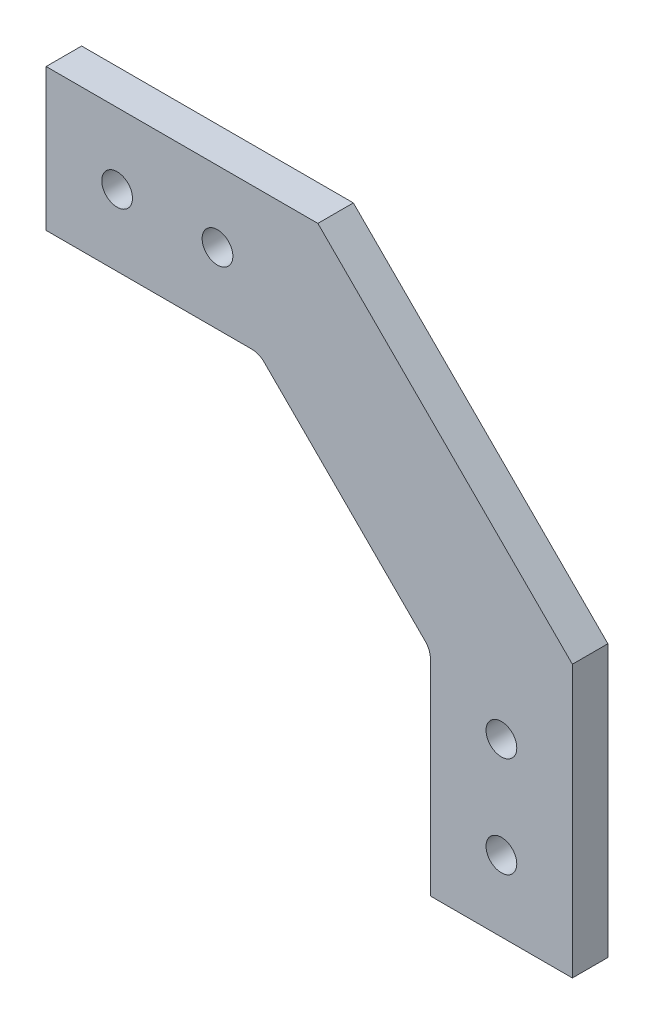
from build123d import *

# Parameters (mm, degrees)
BOSS_EXTRUDE1_DEPTH      = 6.35
FILLET1_R                = 3.175
M5_CLEARANCE_HOLE1_D     = 5.5
M5_CLEARANCE_HOLE1_DEPTH = 18.75
M5_CLEARANCE_HOLE1_TIP   = 1.652366702


with BuildPart() as part:
    # Sketch1 → Boss-Extrude1 (new body)
    with BuildSketch(Plane.XY):
        Polygon((-12.7, 29.029487758), (-12.7, 58.239487758), (-43.360512242, 88.9), (-81.460512242, 88.9), (-81.460512242, 114.3), (-32.839487758, 114.3), (12.7, 68.760512242), (12.7, 37.919487758), (12.7, 29.029487758), (12.7, 20.139487758), (-12.7, 20.139487758), align=None)
    extrude(amount=BOSS_EXTRUDE1_DEPTH)

    # Fillet1
    fillet1_edges = [part.edges().sort_by_distance(p)[0] for p in [
        (-12.7, 58.239487758, 3.175),
        (-43.360512242, 88.9, 3.175),
    ]]
    fillet(fillet1_edges, radius=FILLET1_R)

    # M5 Clearance Hole1
    with Locations(Plane.XY.offset(6.35)):
        with Locations((0, 50.8), (-50.8, 101.6), (-68.760512242, 101.6), (0, 32.839487758)):
            Hole(M5_CLEARANCE_HOLE1_D / 2, depth=M5_CLEARANCE_HOLE1_DEPTH)
            with Locations((0, 0, -(M5_CLEARANCE_HOLE1_DEPTH + M5_CLEARANCE_HOLE1_TIP / 2))):  # 118° drill point
                Cone(0, M5_CLEARANCE_HOLE1_D / 2, M5_CLEARANCE_HOLE1_TIP, mode=Mode.SUBTRACT)


solid = part.part
